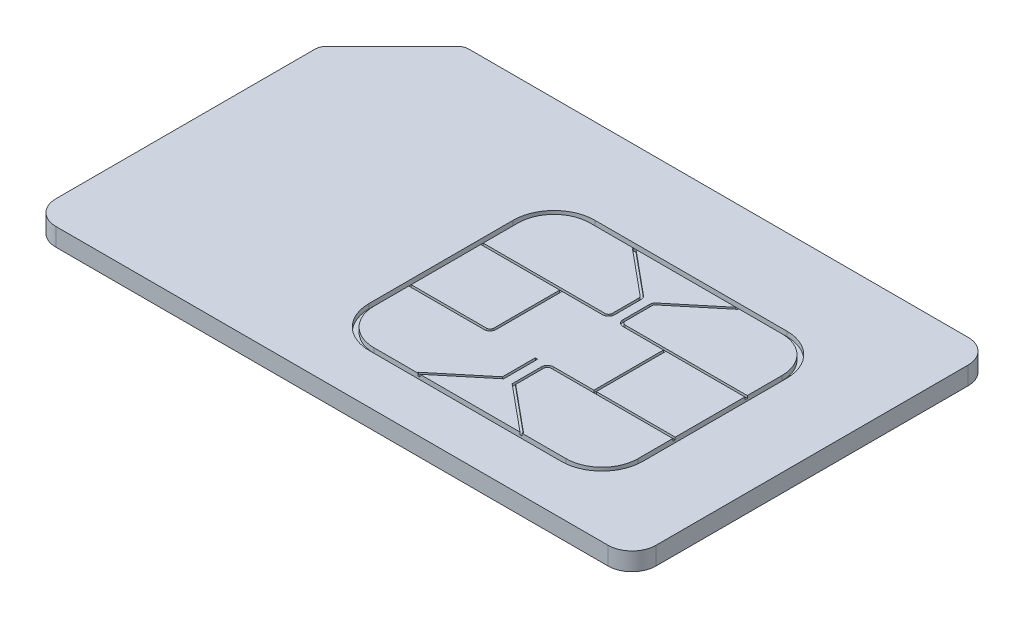
from build123d import *

# Parameters (mm, degrees)
EXTRUDE1_DEPTH          = 0.75
CUT_EXTRUDE_THIN1_DEPTH = 0.2
SKETCH3_W               = 0.1
SKETCH3_H               = 3
CUT_EXTRUDE_THIN6_DEPTH = 0.1


with BuildPart() as part:
    # Sketch1 → Extrude1 (new body)
    with BuildSketch(Plane(origin=(0, 0, 0), x_dir=(1, 0, 0), z_dir=(0, 1, 0))):
        with BuildLine():
            Line((0.146446609, 12.146446609), (2.853553391, 14.853553391))
            ThreePointArc((2.853553391, 14.853553391), (3.015765065, 14.961939766), (3.207106781, 15))
            Line((3.207106781, 15), (24, 15))
            ThreePointArc((24, 15), (24.707106781, 14.707106781), (25, 14))
            Line((25, 14), (25, 1))
            ThreePointArc((25, 1), (24.707106781, 0.292893219), (24, 0))
            Line((24, 0), (1, 0))
            ThreePointArc((1, 0), (0.292893219, 0.292893219), (0, 1))
            Line((0, 1), (0, 11.792893219))
            ThreePointArc((0, 11.792893219), (0.038060234, 11.984234935), (0.146446609, 12.146446609))
        make_face()
    extrude(amount=EXTRUDE1_DEPTH)

    # Sketch2 → Cut-Extrude-Thin1 (cut)
    with BuildSketch(Plane(origin=(0, 0.75, 0), x_dir=(1, 0, 0), z_dir=(0, 1, 0))):
        with BuildLine():
            Line((12, 11.45), (20, 11.45))
            ThreePointArc((20, 11.45), (21.202081528, 10.952081528), (21.7, 9.75))
            Line((21.7, 9.75), (21.7, 3.75))
            ThreePointArc((21.7, 3.75), (21.202081528, 2.547918472), (20, 2.05))
            Line((20, 2.05), (12, 2.05))
            ThreePointArc((12, 2.05), (10.797918472, 2.547918472), (10.3, 3.75))
            Line((10.3, 3.75), (10.3, 9.75))
            ThreePointArc((10.3, 9.75), (10.797918472, 10.952081528), (12, 11.45))
        make_face()
        with BuildLine():
            Line((12, 11.25), (20, 11.25))
            ThreePointArc((20, 11.25), (21.060660172, 10.810660172), (21.5, 9.75))
            Line((21.5, 9.75), (21.5, 3.75))
            ThreePointArc((21.5, 3.75), (21.060660172, 2.689339828), (20, 2.25))
            Line((20, 2.25), (12, 2.25))
            ThreePointArc((12, 2.25), (10.939339828, 2.689339828), (10.5, 3.75))
            Line((10.5, 3.75), (10.5, 9.75))
            ThreePointArc((10.5, 9.75), (10.939339828, 10.810660172), (12, 11.25))
        make_face(mode=Mode.SUBTRACT)
    extrude(amount=-CUT_EXTRUDE_THIN1_DEPTH, mode=Mode.SUBTRACT)

    # Sketch3 → Cut-Extrude-Thin6 (cut)
    with BuildSketch(Plane(origin=(0, 0.75, 0), x_dir=(1, 0, 0), z_dir=(0, 1, 0))):
        with BuildLine():
            Line((10.5, 8.2), (15.574041177, 8.2))
            ThreePointArc((15.574041177, 8.2), (15.750817872, 8.273223305), (15.824041177, 8.45))
            Line((15.824041177, 8.45), (15.824041177, 9.551936806))
            ThreePointArc((15.824041177, 9.551936806), (15.800290975, 9.658290126), (15.733552947, 9.744436144))
            Line((15.733552947, 9.744436144), (13.870171679, 11.288499868))
            Line((13.870171679, 11.288499868), (13.806366971, 11.211500132))
            Line((13.806366971, 11.211500132), (15.669748239, 9.667436409))
            ThreePointArc((15.669748239, 9.667436409), (15.709791056, 9.615748798), (15.724041177, 9.551936806))
            Line((15.724041177, 9.551936806), (15.724041177, 8.45))
            ThreePointArc((15.724041177, 8.45), (15.680107194, 8.343933983), (15.574041177, 8.3))
            Line((15.574041177, 8.3), (10.5, 8.3))
            Line((10.5, 8.3), (10.5, 8.2))
        make_face()
        with BuildLine():
            Line((21.5, 8.3), (16.425958823, 8.3))
            ThreePointArc((16.425958823, 8.3), (16.319892806, 8.343933983), (16.275958823, 8.45))
            Line((16.275958823, 8.45), (16.275958823, 9.551936806))
            ThreePointArc((16.275958823, 9.551936806), (16.290208944, 9.615748798), (16.330251761, 9.667436409))
            Line((16.330251761, 9.667436409), (18.193633029, 11.211500132))
            Line((18.193633029, 11.211500132), (18.129828321, 11.288499868))
            Line((18.129828321, 11.288499868), (16.266447053, 9.744436144))
            ThreePointArc((16.266447053, 9.744436144), (16.199709025, 9.658290126), (16.175958823, 9.551936806))
            Line((16.175958823, 9.551936806), (16.175958823, 8.45))
            ThreePointArc((16.175958823, 8.45), (16.249182128, 8.273223305), (16.425958823, 8.2))
            Line((16.425958823, 8.2), (21.5, 8.2))
            Line((21.5, 8.2), (21.5, 8.3))
        make_face()
        with BuildLine():
            Line((21.5, 5.3), (16.425958823, 5.3))
            ThreePointArc((16.425958823, 5.3), (16.249182128, 5.226776695), (16.175958823, 5.05))
            Line((16.175958823, 5.05), (16.175958823, 3.830545608))
            Line((16.175958823, 3.830545608), (18.129828321, 2.211500132))
            Line((18.129828321, 2.211500132), (18.193633029, 2.288499868))
            Line((18.193633029, 2.288499868), (16.275958823, 3.877552643))
            Line((16.275958823, 3.877552643), (16.275958823, 5.05))
            ThreePointArc((16.275958823, 5.05), (16.319892806, 5.156066017), (16.425958823, 5.2))
            Line((16.425958823, 5.2), (21.5, 5.2))
            Line((21.5, 5.2), (21.5, 5.3))
        make_face()
        Polygon((15.724041177, 5.25), (15.724041177, 3.877552643), (13.806366971, 2.288499868), (13.870171679, 2.211500132), (15.824041177, 3.830545608), (15.824041177, 5.25), align=None)
        with BuildLine():
            Line((10.5, 5.2), (13.638269325, 5.2))
            ThreePointArc((13.638269325, 5.2), (13.815046021, 5.273223305), (13.888269325, 5.45))
            Line((13.888269325, 5.45), (13.888269325, 8.25))
            Line((13.888269325, 8.25), (13.788269325, 8.25))
            Line((13.788269325, 8.25), (13.788269325, 5.45))
            ThreePointArc((13.788269325, 5.45), (13.744335343, 5.343933983), (13.638269325, 5.3))
            Line((13.638269325, 5.3), (10.5, 5.3))
            Line((10.5, 5.3), (10.5, 5.2))
        make_face()
        with Locations((18.161730675, 6.75)):
            Rectangle(SKETCH3_W, SKETCH3_H)
    extrude(amount=-CUT_EXTRUDE_THIN6_DEPTH, mode=Mode.SUBTRACT)


solid = part.part
